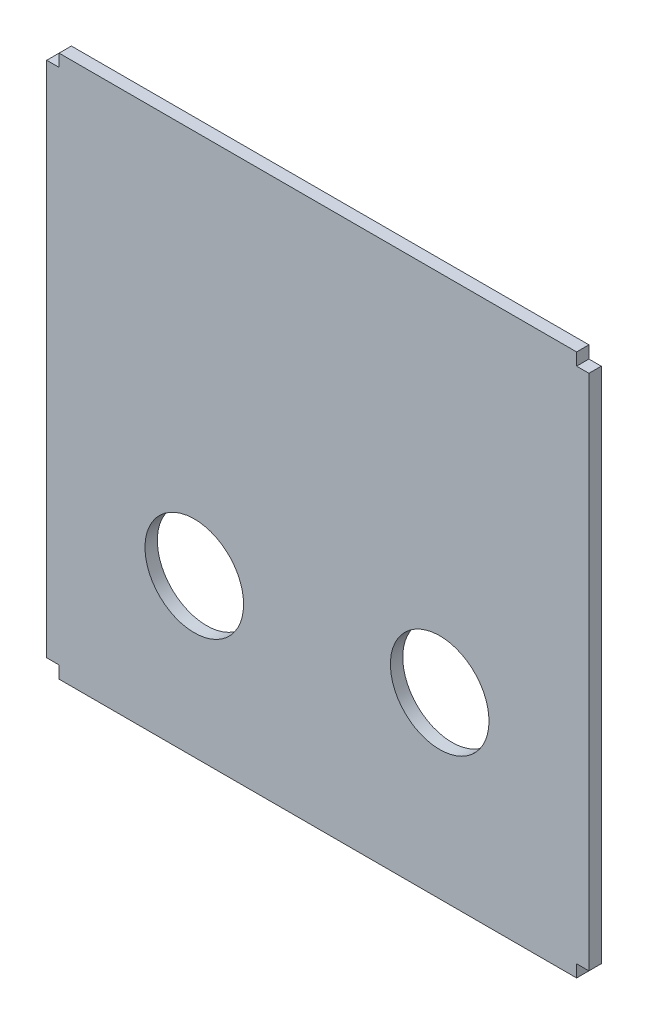
from build123d import *

# Parameters (mm, degrees)
SKETCH1_W           = 279.4
SKETCH1_H           = 279.4
BOSS_EXTRUDE1_DEPTH = 6.35
SKETCH3_R           = 25.4
CUT_EXTRUDE2_DEPTH  = 198.667656687
SKETCH4_W           = 6.35
SKETCH4_H           = 6.35
CUT_EXTRUDE3_DEPTH  = 198.667656687


with BuildPart() as part:
    # Sketch1 → Boss-Extrude1 (new body)
    with BuildSketch(Plane.XY):
        Rectangle(SKETCH1_W, SKETCH1_H)
    extrude(amount=BOSS_EXTRUDE1_DEPTH)

    # Sketch3 → Cut-Extrude2 (cut, through all)
    with BuildSketch(Plane.XY.offset(6.35)):
        with Locations((-63.668986787, -58.7375)):
            Circle(SKETCH3_R)
        with Locations((62.797291543, -47.625)):
            Circle(SKETCH3_R)
    extrude(amount=-CUT_EXTRUDE2_DEPTH, mode=Mode.SUBTRACT)

    # Sketch4 → Cut-Extrude3 (cut, through all)
    with BuildSketch(Plane.XY.offset(6.35)):
        with Locations((-136.525, 136.525)):
            Rectangle(SKETCH4_W, SKETCH4_H)
        with Locations((136.525, 136.525)):
            Rectangle(SKETCH4_W, SKETCH4_H)
        with Locations((136.525, -136.525)):
            Rectangle(SKETCH4_W, SKETCH4_H)
        with Locations((-136.525, -136.525)):
            Rectangle(SKETCH4_W, SKETCH4_H)
    extrude(amount=-CUT_EXTRUDE3_DEPTH, mode=Mode.SUBTRACT)


solid = part.part
